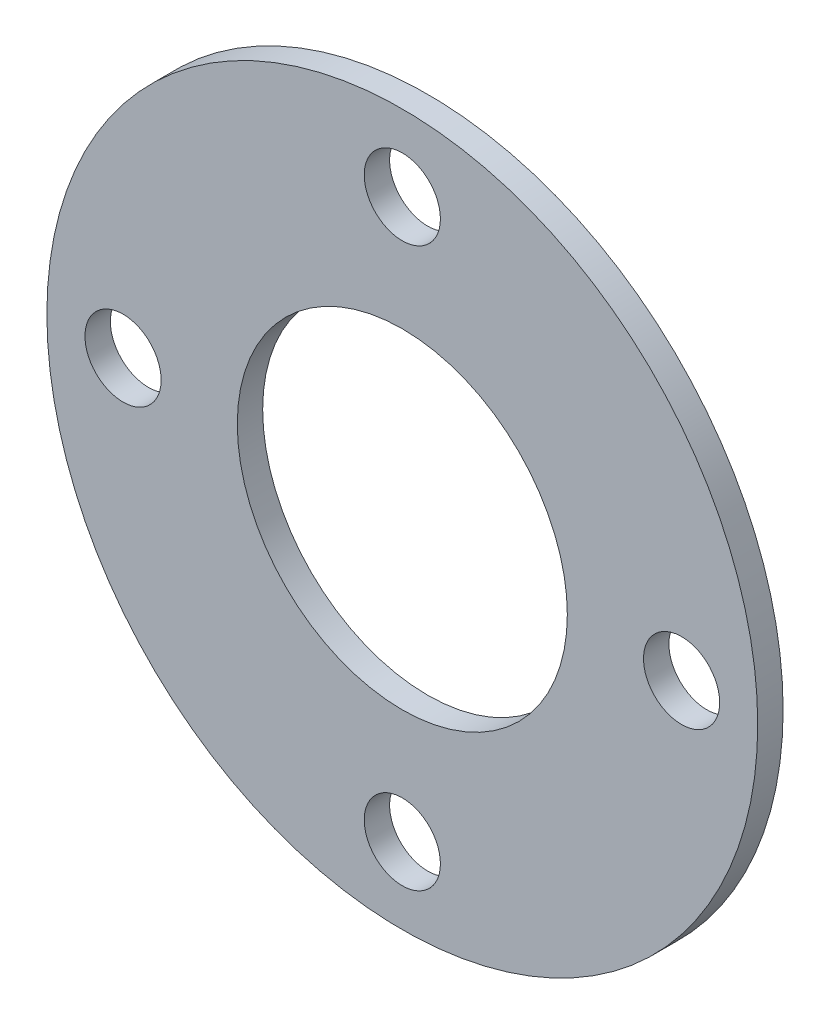
from build123d import *

# Parameters (mm, degrees)
SKETCH1_R           = 14
SKETCH1_R_2         = 1.5
SKETCH1_R_3         = 6.5
BOSS_EXTRUDE1_DEPTH = 1


with BuildPart() as part:
    # Sketch1 → Boss-Extrude1 (new body)
    with BuildSketch(Plane.XY):
        Circle(SKETCH1_R)
        with Locations((11, 0)):
            Circle(SKETCH1_R_2, mode=Mode.SUBTRACT)
        with Locations((0, -11)):
            Circle(SKETCH1_R_2, mode=Mode.SUBTRACT)
        with Locations((-11, 0)):
            Circle(SKETCH1_R_2, mode=Mode.SUBTRACT)
        with Locations((0, 11)):
            Circle(SKETCH1_R_2, mode=Mode.SUBTRACT)
        Circle(SKETCH1_R_3, mode=Mode.SUBTRACT)
    extrude(amount=BOSS_EXTRUDE1_DEPTH)


solid = part.part
